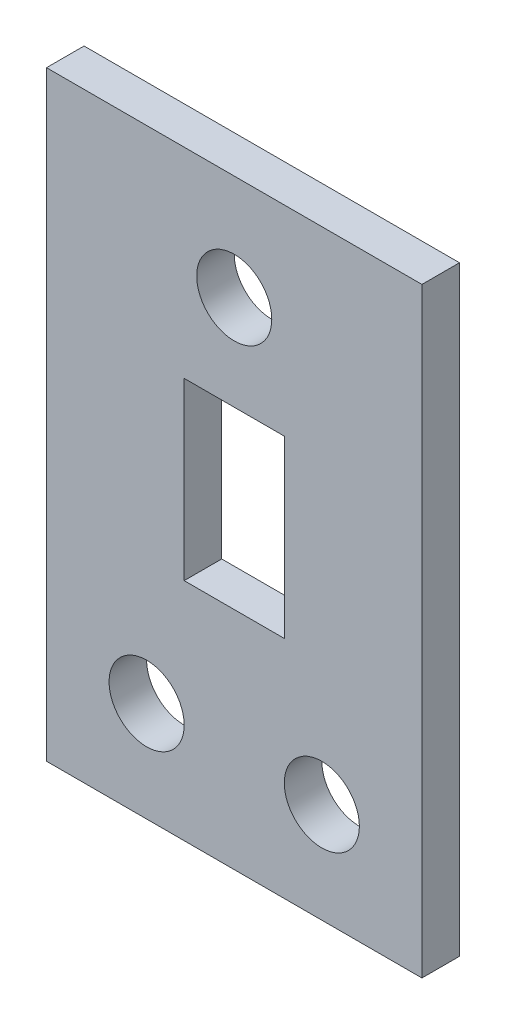
from build123d import *

# Parameters (mm, degrees)
ESQUISSE1_W      = 15
ESQUISSE1_H      = 24
EXTRUSION1_DEPTH = 1.5
ESQUISSE2_R      = 1.5
ESQUISSE2_W      = 4
ESQUISSE2_H      = 7
EXTRUSION2_DEPTH = 2


with BuildPart() as part:
    # Esquisse1 → Extrusion1 (new body)
    with BuildSketch(Plane.XY):
        with Locations((-5.045528485, 20.953157895)):
            Rectangle(ESQUISSE1_W, ESQUISSE1_H)
    extrude(amount=EXTRUSION1_DEPTH)

    # Esquisse2 → Extrusion2 (cut)
    with BuildSketch(Plane.XY.offset(1.5)):
        with Locations((-8.545528485, 12.953157895)):
            Circle(ESQUISSE2_R)
        with Locations((-1.545528485, 12.953157895)):
            Circle(ESQUISSE2_R)
        with Locations((-5.045528485, 28.747386529)):
            Circle(ESQUISSE2_R)
        with Locations((-5.045528485, 21.453157895)):
            Rectangle(ESQUISSE2_W, ESQUISSE2_H)
    extrude(amount=-EXTRUSION2_DEPTH, mode=Mode.SUBTRACT)


solid = part.part
